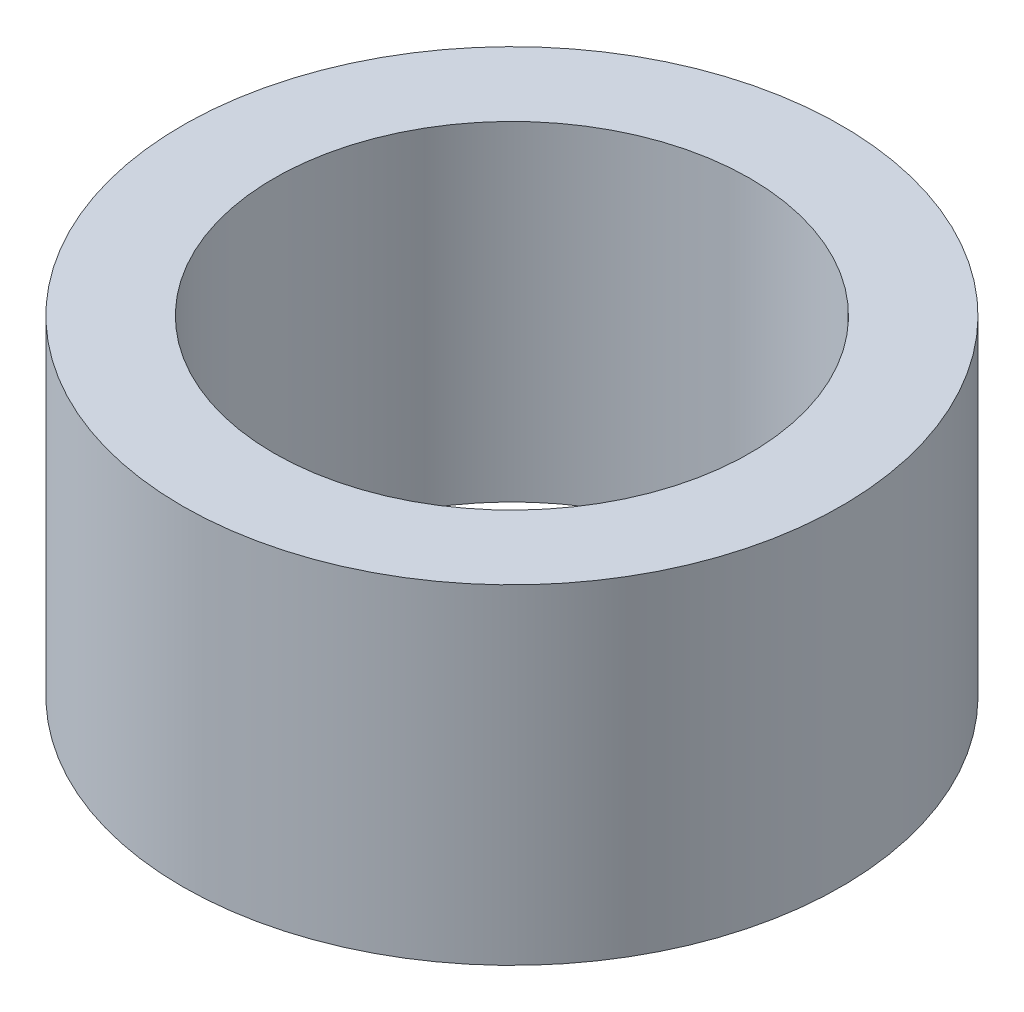
from build123d import *

# Parameters (mm, degrees)
SKETCH1_R           = 4.572
SKETCH1_R_2         = 3.302
BOSS_EXTRUDE1_DEPTH = 4.572


with BuildPart() as part:
    # Sketch1 → Boss-Extrude1 (new body)
    with BuildSketch(Plane(origin=(0, 0, 0), x_dir=(1, 0, 0), z_dir=(0, 1, 0))):
        with Locations(Location((0, 0, 0), (0, 0, 270))):
            Circle(SKETCH1_R)
        with Locations(Location((0, 0, 0), (0, 0, 270))):
            Circle(SKETCH1_R_2, mode=Mode.SUBTRACT)
    extrude(amount=BOSS_EXTRUDE1_DEPTH)


solid = part.part
